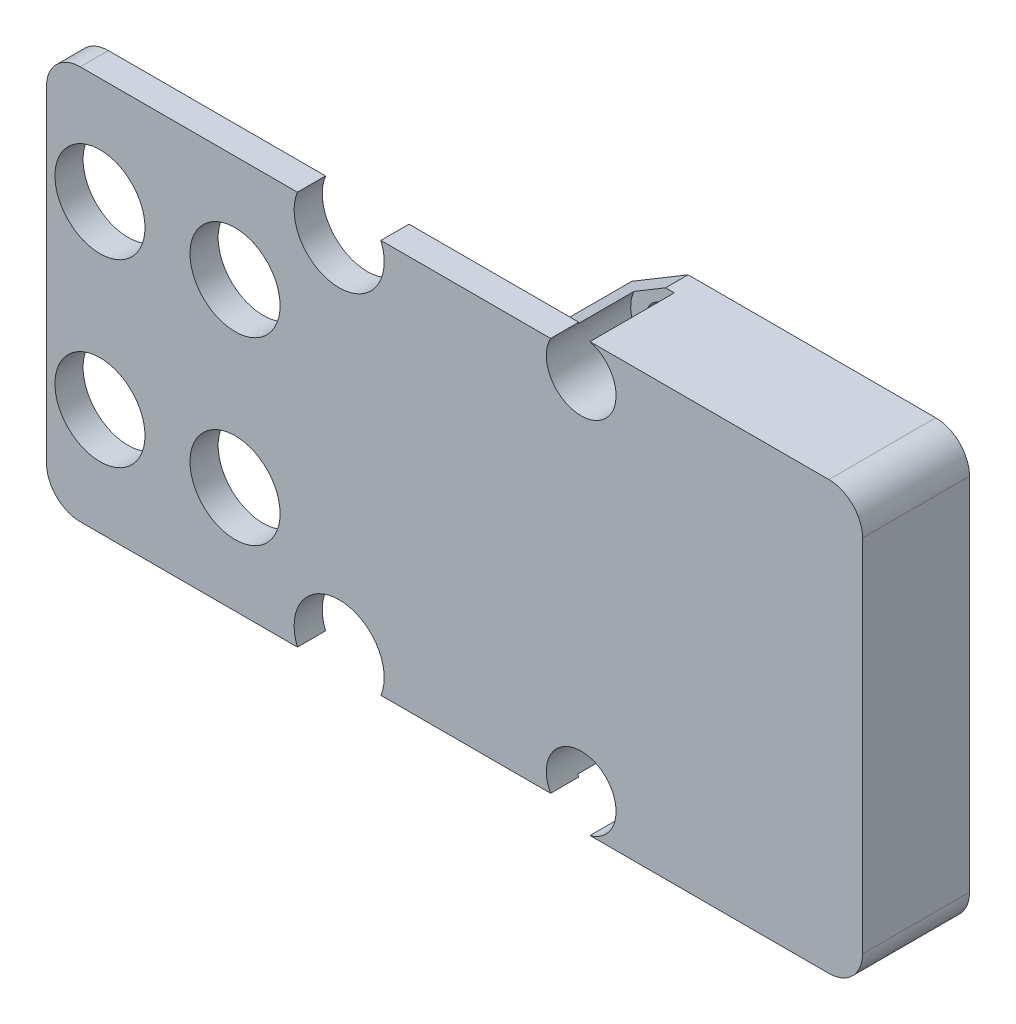
from build123d import *

# Parameters (mm, degrees)
CROQUIS1_R              = 1.707370132
SALIENTE_EXTRUIR1_DEPTH = 9.5
SALIENTE_EXTRUIR2_DEPTH = 2.5
CROQUIS5_R              = 4
CROQUIS5_R_2            = 3.5
CORTAR_EXTRUIR1_DEPTH   = 2.5
REDONDEO1_R             = 3
CROQUIS6_R              = 3.1
CORTAR_EXTRUIR2_DEPTH   = 7.5


with BuildPart() as part:
    # Croquis1 → Saliente-Extruir1 (new body)
    with BuildSketch(Plane.XY):
        Polygon((-69.586479396, 30.699597615), (-44.586479396, 30.699597615), (-44.586479396, -7.300402385), (-69.586479396, -7.300402385), (-74.586479396, -4.300402385), (-74.586479396, 27.699597615), align=None)
        with Locations((-69.586479396, 27.699597615)):
            Circle(CROQUIS1_R, mode=Mode.SUBTRACT)
        with Locations((-69.586479396, -4.300402385)):
            Circle(CROQUIS1_R, mode=Mode.SUBTRACT)
    extrude(amount=SALIENTE_EXTRUIR1_DEPTH)

    # Croquis4 → Saliente-Extruir2 (add)
    with BuildSketch(Plane.XY.offset(9.5)):
        Polygon((-72.086479396, 29.199597615), (-117.086479396, 29.199597615), (-117.086479396, -5.800402385), (-72.086479396, -5.800402385), (-74.586479396, -4.300402385), (-74.586479396, 27.699597615), align=None)
    extrude(amount=-SALIENTE_EXTRUIR2_DEPTH)

    # Croquis5 → Cortar-Extruir1 (cut)
    with BuildSketch(Plane.XY.offset(9.5)):
        with Locations((-91.086479396, -4.300402385)):
            Circle(CROQUIS5_R)
        with Locations((-91.086479396, 27.699597615)):
            Circle(CROQUIS5_R)
        with Locations((-121.586479396, -4.300402385)):
            Circle(CROQUIS5_R_2)
        with Locations((-121.586479396, 27.699597615)):
            Circle(CROQUIS5_R_2)
        with Locations((-100.336479396, 19.699597615)):
            Circle(CROQUIS5_R)
        with Locations((-112.336479396, 19.699597615)):
            Circle(CROQUIS5_R)
        with Locations((-112.336479396, 3.699597615)):
            Circle(CROQUIS5_R)
        with Locations((-100.336479396, 3.699597615)):
            Circle(CROQUIS5_R)
    extrude(amount=-CORTAR_EXTRUIR1_DEPTH, mode=Mode.SUBTRACT)

    # Redondeo1
    redondeo1_edges = [part.edges().sort_by_distance(p)[0] for p in [
        (-44.586479396, 30.699597615, 4.75),
        (-44.586479396, -7.300402385, 4.75),
        (-117.086479396, -5.800402385, 8.25),
        (-117.086479396, 29.199597615, 8.25),
    ]]
    fillet(redondeo1_edges, radius=REDONDEO1_R)

    # Croquis6 → Cortar-Extruir2 (cut)
    with BuildSketch(Plane.XY.offset(9.5)):
        with Locations((-69.586479396, 27.699597615)):
            Circle(CROQUIS6_R)
        with Locations((-69.586479396, -4.300402385)):
            Circle(CROQUIS6_R)
    extrude(amount=-CORTAR_EXTRUIR2_DEPTH, mode=Mode.SUBTRACT)


solid = part.part
